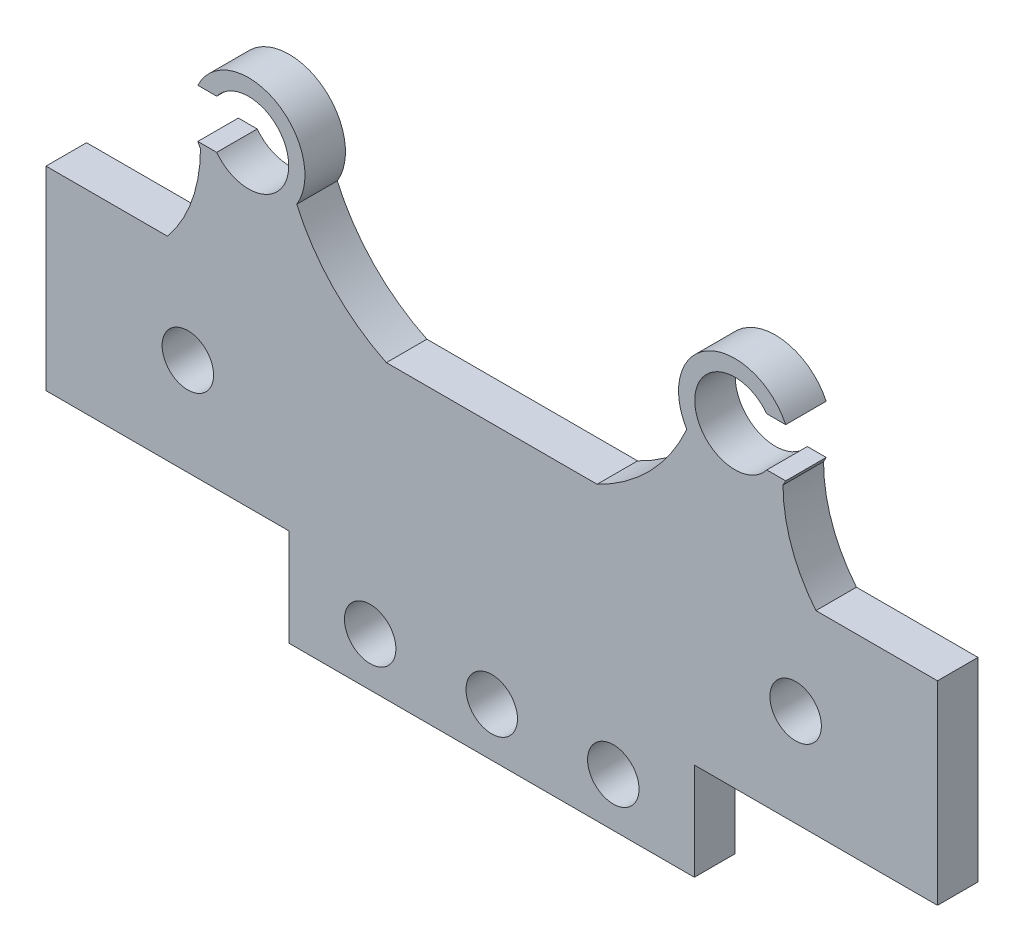
from build123d import *

# Parameters (mm, degrees)
CROQUIS1_R              = 4.95
CROQUIS1_R_2            = 3.175
SALIENTE_EXTRUIR1_DEPTH = 5
CORTAR_EXTRUIR1_DEPTH   = 66.924198895


with BuildPart() as part:
    # Croquis1 → Saliente-Extruir1 (new body)
    with BuildSketch(Plane.XY):
        with BuildLine():
            Line((13, 0), (-13, 0))
            ThreePointArc((-13, 0), (-19.544656296, 4.709966775), (-24.061489507, 11.389377737))
            ThreePointArc((-24.061489507, 11.389377737), (-30, 21.95), (-35.938510493, 11.389377737))
            ThreePointArc((-35.938510493, 11.389377737), (-36.984260452, 5.34343649), (-40, 0))
            Line((-40, 0), (-55, 0))
            Line((-55, 0), (-55, -24))
            Line((-55, -24), (-25, -24))
            Line((-25, -24), (-25, -36))
            Line((-25, -36), (25, -36))
            Line((25, -36), (25, -24))
            Line((25, -24), (55, -24))
            Line((55, -24), (55, 0))
            Line((55, 0), (40, 0))
            ThreePointArc((40, 0), (36.984260452, 5.34343649), (35.938510493, 11.389377737))
            ThreePointArc((35.938510493, 11.389377737), (30, 21.95), (24.061489507, 11.389377737))
            ThreePointArc((24.061489507, 11.389377737), (19.544656296, 4.709966775), (13, 0))
        make_face()
        with Locations((-30, 15)):
            Circle(CROQUIS1_R, mode=Mode.SUBTRACT)
        with Locations((-37.5, -12)):
            Circle(CROQUIS1_R_2, mode=Mode.SUBTRACT)
        with Locations((0, -30)):
            Circle(CROQUIS1_R_2, mode=Mode.SUBTRACT)
        with Locations(Location((30, 15, 0), (0, 0, 180))):
            Circle(CROQUIS1_R, mode=Mode.SUBTRACT)
        with Locations(Location((37.5, -12, 0), (0, 0, 180))):
            Circle(CROQUIS1_R_2, mode=Mode.SUBTRACT)
        with Locations((-15, -30)):
            Circle(CROQUIS1_R_2, mode=Mode.SUBTRACT)
        with Locations(Location((15, -30, 0), (0, 0, 180))):
            Circle(CROQUIS1_R_2, mode=Mode.SUBTRACT)
    extrude(amount=SALIENTE_EXTRUIR1_DEPTH)

    # Croquis2 → Cortar-Extruir1 (cut, through all)
    with BuildSketch(Plane.XY):
        with BuildLine():
            Line((-30, 18), (-36.269170599, 18))
            ThreePointArc((-36.269170599, 18), (-36.95, 15), (-36.269170599, 12))
            Line((-36.269170599, 12), (-30, 12))
            Line((-30, 12), (-30, 18))
        make_face()
        with BuildLine():
            Line((30, 18), (30, 12))
            Line((30, 12), (36.269170599, 12))
            ThreePointArc((36.269170599, 12), (36.95, 15), (36.269170599, 18))
            Line((36.269170599, 18), (30, 18))
        make_face()
    extrude(amount=CORTAR_EXTRUIR1_DEPTH, mode=Mode.SUBTRACT)


solid = part.part
